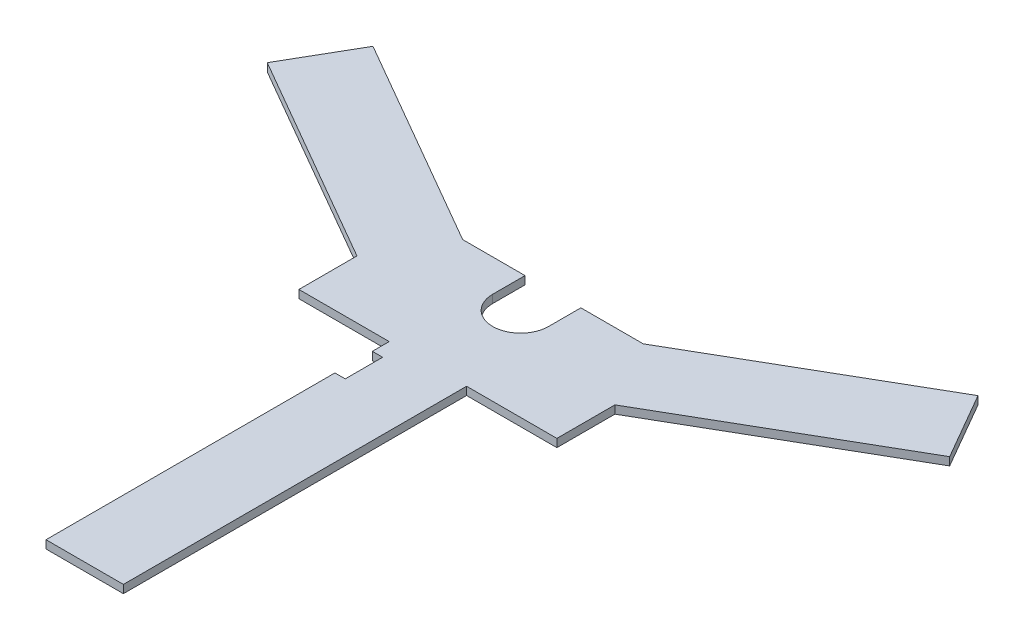
from build123d import *

# Parameters (mm, degrees)
SKETCH1_W           = 15.24
SKETCH1_H           = 19.327878735
SKETCH1_H_2         = 48.26
BOSS_EXTRUDE2_DEPTH = 1.5875
SKETCH6_W           = 2.032
SKETCH6_H           = 7.366
CUT_EXTRUDE4_DEPTH  = 2.54


with BuildPart() as part:
    # Sketch1 → Boss-Extrude2 (new body)
    with BuildSketch(Plane(origin=(0, 0, 0), x_dir=(1, 0, 0), z_dir=(0, 1, 0))):
        Polygon((50.8, 11.43), (0, 11.43), (0, 0), (17.78, 0), (33.02, 0), (50.8, 0), align=None)
        with BuildLine():
            Line((7.62, 24.628227154), (0, 11.43))
            Line((0, 11.43), (50.8, 11.43))
            Line((50.8, 11.43), (43.18, 24.628227154))
            Line((43.18, 24.628227154), (30.9, 24.628227154))
            Line((30.9, 24.628227154), (30.9, 18.264121265))
            ThreePointArc((30.9, 18.264121265), (25.4, 12.764121265), (19.9, 18.264121265))
            Line((19.9, 18.264121265), (19.9, 24.628227154))
            Line((19.9, 24.628227154), (7.62, 24.628227154))
        make_face()
        with Locations((25.4, -9.663939368)):
            Rectangle(SKETCH1_W, SKETCH1_H)
        Polygon((-41.794385987, 35.56), (-34.174385987, 48.758227154), (7.62, 24.628227154), (0, 11.43), align=None)
        with Locations((25.4, -43.457878735)):
            Rectangle(SKETCH1_W, SKETCH1_H_2)
        Polygon((84.974385987, 48.758227154), (92.594385987, 35.56), (50.8, 11.43), (43.18, 24.628227154), align=None)
    extrude(amount=BOSS_EXTRUDE2_DEPTH)

    # Sketch6 → Cut-Extrude4 (cut)
    with BuildSketch(Plane(origin=(0, 0, 0), x_dir=(-1, 0, 0), z_dir=(0, -1, 0))):
        with Locations((-18.796, -7.008878735)):
            Rectangle(SKETCH6_W, SKETCH6_H)
    extrude(amount=-CUT_EXTRUDE4_DEPTH, mode=Mode.SUBTRACT)


solid = part.part
